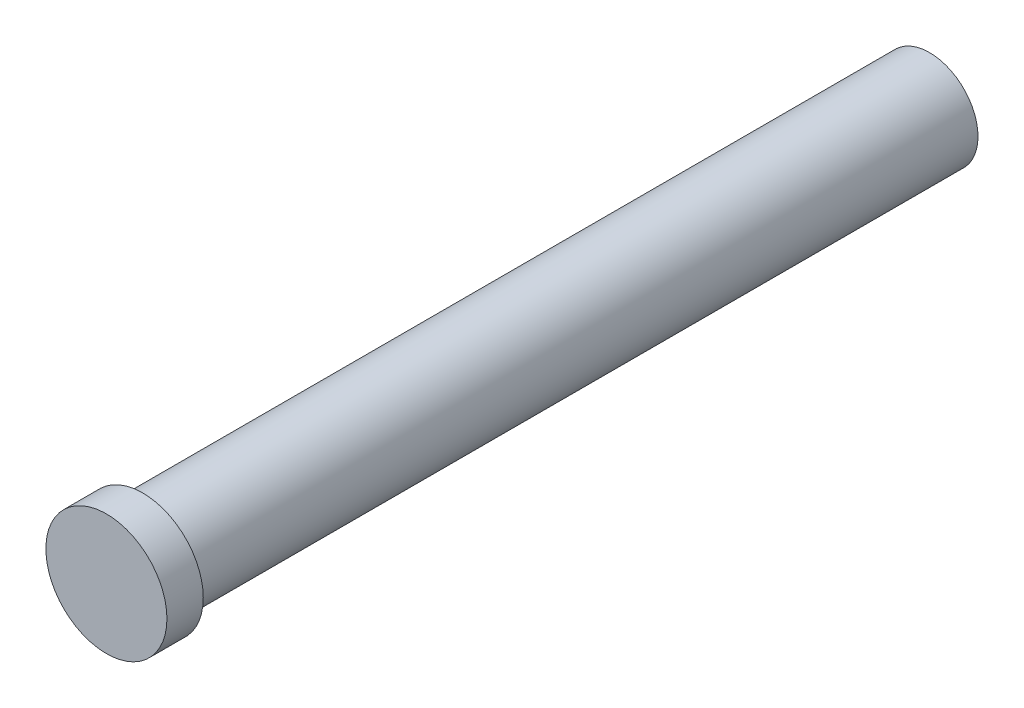
from build123d import *

# Parameters (mm, degrees)
SKETCH1_R           = 4
BOSS_EXTRUDE1_DEPTH = 65
SKETCH2_R           = 5
BOSS_EXTRUDE2_DEPTH = 3


with BuildPart() as part:
    # Sketch1 → Boss-Extrude1 (new body)
    with BuildSketch(Plane.XY):
        Circle(SKETCH1_R)
    extrude(amount=BOSS_EXTRUDE1_DEPTH)

    # Sketch2 → Boss-Extrude2 (add)
    with BuildSketch(Plane.XY.offset(65)):
        Circle(SKETCH2_R)
    extrude(amount=BOSS_EXTRUDE2_DEPTH)


solid = part.part
